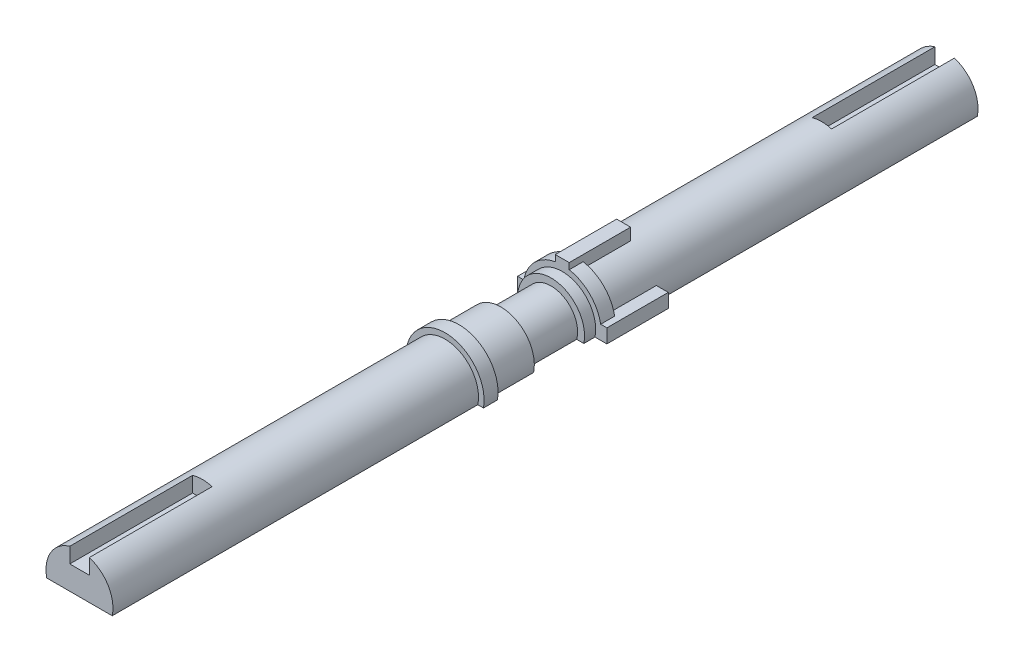
from build123d import *
from build123d.topology import SkipClean

# Parameters (mm, degrees)
BOSS_EXTRUDE1_DEPTH = 8
BOSS_EXTRUDE2_DEPTH = 26
BOSS_EXTRUDE3_DEPTH = 2.5
BOSS_EXTRUDE4_START = -5
BOSS_EXTRUDE4_DEPTH = 2.5
BOSS_EXTRUDE5_START = 8
BOSS_EXTRUDE5_DEPTH = 8
SKETCH12_W          = 2.5
SKETCH12_H          = 2.131652703
SKETCH12_W_2        = 2.131652703
SKETCH12_H_2        = 2.5
BOSS_EXTRUDE6_DEPTH = 3
BOSS_EXTRUDE7_DEPTH = 60.5
BOSS_EXTRUDE8_START = 52.5
BOSS_EXTRUDE8_DEPTH = 52.5
CUT_EXTRUDE1_DEPTH  = 22
CUT_EXTRUDE2_START  = 2
CUT_EXTRUDE2_DEPTH  = 9


with BuildPart() as part:
    # Sketch1 → Boss-Extrude1 (new body)
    with BuildSketch(Plane.XY):
        with BuildLine():
            Line((8, 1.25), (5.868347297, 1.25))
            ThreePointArc((5.868347297, 1.25), (4.242640687, 4.242640687), (1.25, 5.868347297))
            Line((1.25, 5.868347297), (1.25, 8))
            Line((1.25, 8), (-1.25, 8))
            Line((-1.25, 8), (-1.25, 5.868347297))
            ThreePointArc((-1.25, 5.868347297), (-4.242640687, 4.242640687), (-5.868347297, 1.25))
            Line((-5.868347297, 1.25), (-8, 1.25))
            Line((-8, 1.25), (-8, -1.25))
            Line((-8, -1.25), (8, -1.25))
            Line((8, -1.25), (8, 1.25))
        make_face()
    extrude(amount=BOSS_EXTRUDE1_DEPTH)

    # Sketch3 → Boss-Extrude2 (add)
    with BuildSketch(Plane.XY.offset(8)):
        with BuildLine():
            Line((-5.868347297, -1.25), (5.868347297, -1.25))
            ThreePointArc((5.868347297, -1.25), (0, 6), (-5.868347297, -1.25))
        make_face()
    extrude(amount=BOSS_EXTRUDE2_DEPTH)

    # Sketch5 → Boss-Extrude3 (add)
    with BuildSketch(Plane.XY.offset(8)):
        with BuildLine():
            Line((-6.887488657, -1.25), (6.887488657, -1.25))
            ThreePointArc((6.887488657, -1.25), (0, 7), (-6.887488657, -1.25))
        make_face()
    extrude(amount=-BOSS_EXTRUDE3_DEPTH)

    # Sketch10 → Boss-Extrude5 (add)
    with SkipClean():  # the faces are left unmerged after this step: merging them gives an invalid solid
        with BuildSketch(Plane(origin=(0, 0, 0), x_dir=(-1, 0, 0), z_dir=(0, 0, -1)).offset(BOSS_EXTRUDE5_START)):
            with BuildLine():
                Line((-5.868347297, -1.25), (5.868347297, -1.25))
                ThreePointArc((5.868347297, -1.25), (0, 6), (-5.868347297, -1.25))
            make_face()
        extrude(amount=-BOSS_EXTRUDE5_DEPTH)

    # Sketch12 → Boss-Extrude6 (add)
    with SkipClean():  # the faces are left unmerged after this step: merging them gives an invalid solid
        with BuildSketch(Plane(origin=(0, 0, 0), x_dir=(-1, 0, 0), z_dir=(0, 0, -1))):
            with Locations((0, 6.934173648)):
                Rectangle(SKETCH12_W, SKETCH12_H)
            with Locations((6.934173648, 0)):
                Rectangle(SKETCH12_W_2, SKETCH12_H_2)
            with Locations((-6.934173648, 0)):
                Rectangle(SKETCH12_W_2, SKETCH12_H_2)
        extrude(amount=BOSS_EXTRUDE6_DEPTH)

    # Sketch14 → Boss-Extrude7 (add)
    with SkipClean():  # the faces are left unmerged after this step: merging them gives an invalid solid
        with BuildSketch(Plane.XY.offset(34)):
            with BuildLine():
                Line((-5.868347297, -1.25), (5.868347297, -1.25))
                ThreePointArc((5.868347297, -1.25), (0, 6), (-5.868347297, -1.25))
            make_face()
        extrude(amount=BOSS_EXTRUDE7_DEPTH)

    # Sketch15 → Boss-Extrude8 (add)
    with SkipClean():  # the faces are left unmerged after this step: merging them gives an invalid solid
        with BuildSketch(Plane(origin=(0, 0, -8), x_dir=(-1, 0, 0), z_dir=(0, 0, -1)).offset(BOSS_EXTRUDE8_START)):
            with BuildLine():
                Line((-5.868347297, -1.25), (5.868347297, -1.25))
                ThreePointArc((5.868347297, -1.25), (0, 6), (-5.868347297, -1.25))
            make_face()
        extrude(amount=-BOSS_EXTRUDE8_DEPTH)

    # Sketch16 → Cut-Extrude1 (cut)
    with SkipClean():  # the faces are left unmerged after this step: merging them gives an invalid solid
        with BuildSketch(Plane(origin=(0, 0, -60.5), x_dir=(-1, 0, 0), z_dir=(0, 0, -1))):
            with BuildLine():
                Line((-1.762062123, 5.735428238), (-1.762062123, 2.994133291))
                Line((-1.762062123, 2.994133291), (1.737937877, 2.994133291))
                Line((1.737937877, 2.994133291), (1.737937877, 5.742784336))
                ThreePointArc((1.737937877, 5.742784336), (-0.012610426, 5.999986748), (-1.762062123, 5.735428238))
            make_face()
        cut_extrude1 = extrude(amount=-CUT_EXTRUDE1_DEPTH, mode=Mode.SUBTRACT)

    # Mirror1: Cut-Extrude1 across plane
    with SkipClean():  # the faces are left unmerged after this step: merging them gives an invalid solid
        add(cut_extrude1.mirror(Plane.XY.offset(17)), mode=Mode.SUBTRACT)

    # Sketch17 → Cut-Extrude2 (cut)
    with SkipClean():  # the faces are left unmerged after this step: merging them gives an invalid solid
        with BuildSketch(Plane.XY.offset(8).offset(CUT_EXTRUDE2_START)):
            with BuildLine():
                Line((-9.528418517, -1.25), (-4.582575695, -1.25))
                ThreePointArc((-4.582575695, -1.25), (0, 4.75), (4.582575695, -1.25))
                Line((4.582575695, -1.25), (9.528418517, -1.25))
                ThreePointArc((9.528418517, -1.25), (0, 9.610060324), (-9.528418517, -1.25))
            make_face()
        extrude(amount=CUT_EXTRUDE2_DEPTH, mode=Mode.SUBTRACT)


with BuildPart() as body_2:
    # Sketch9 → Boss-Extrude4 (new body)
    with BuildSketch(Plane.XY.offset(34).offset(BOSS_EXTRUDE4_START)):
        with BuildLine():
            Line((-6.887488657, -1.25), (6.887488657, -1.25))
            ThreePointArc((6.887488657, -1.25), (0, 7), (-6.887488657, -1.25))
        make_face()
    extrude(amount=-BOSS_EXTRUDE4_DEPTH)


solid = Compound([part.part, body_2.part])
